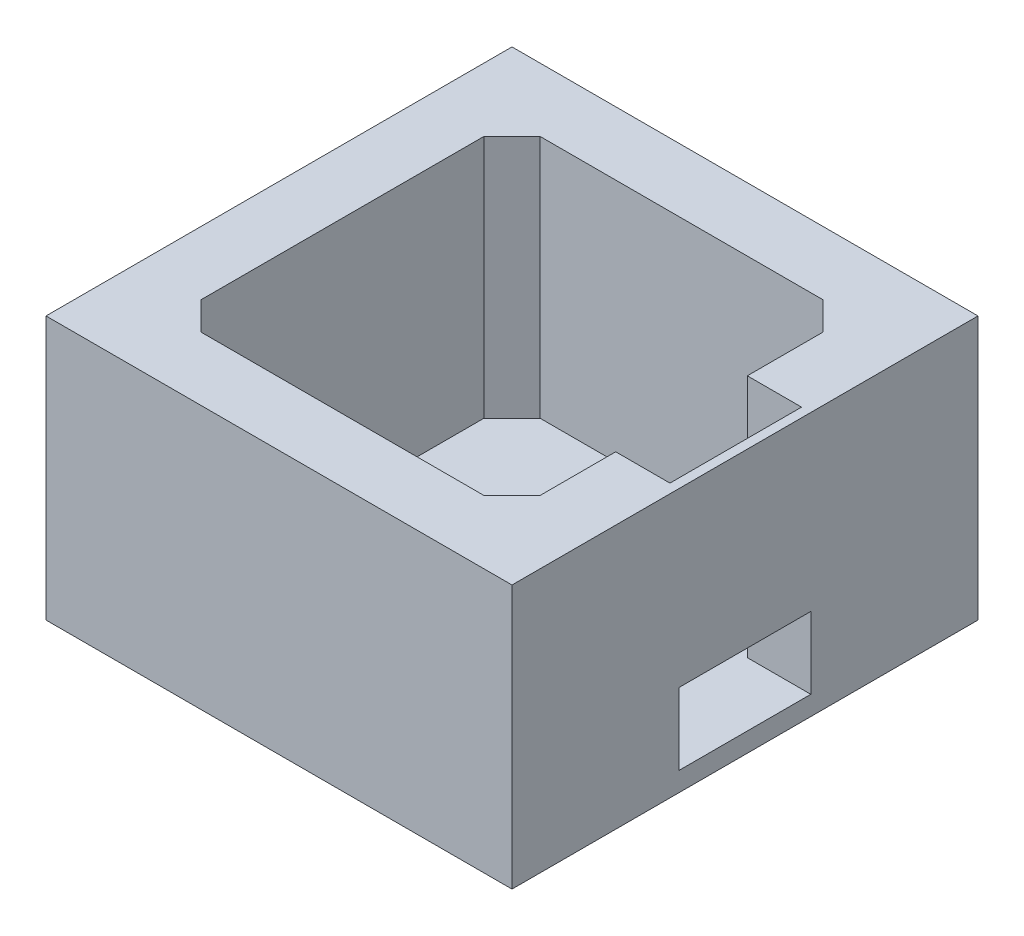
from build123d import *

# Parameters (mm, degrees)
SKETCH1_W           = 58.42
SKETCH1_H           = 58.42
BOSS_EXTRUDE1_DEPTH = 33.02
CUT_EXTRUDE1_DEPTH  = 30.600000014
SKETCH3_W           = 16.5
SKETCH3_H           = 9
CUT_EXTRUDE2_DEPTH  = 30.600000014


with BuildPart() as part:
    # Sketch1 → Boss-Extrude1 (new body)
    with BuildSketch(Plane(origin=(0, 0, 0), x_dir=(1, 0, 0), z_dir=(0, 1, 0))):
        with Locations((29.21, 29.21)):
            Rectangle(SKETCH1_W, SKETCH1_H)
    extrude(amount=BOSS_EXTRUDE1_DEPTH)

    # Sketch2 → Cut-Extrude1 (cut)
    with BuildSketch(Plane(origin=(0, 33.02, 0), x_dir=(1, 0, 0), z_dir=(0, 1, 0))):
        Polygon((11.495533906, 50.46), (46.924466094, 50.46), (50.46, 46.924466094), (50.46, 37.46), (57.26, 37.46), (57.26, 20.96), (50.46, 20.96), (50.46, 11.495533906), (46.924466094, 7.96), (11.495533906, 7.96), (7.96, 11.495533906), (7.96, 46.924466094), align=None)
    extrude(amount=-CUT_EXTRUDE1_DEPTH, mode=Mode.SUBTRACT)

    # Sketch3 → Cut-Extrude2 (cut)
    with BuildSketch(Plane(origin=(58.42, 0, 0), x_dir=(0, 0, -1), z_dir=(1, 0, 0))):
        with Locations((29.21, 6.919999986)):
            Rectangle(SKETCH3_W, SKETCH3_H)
    extrude(amount=-CUT_EXTRUDE2_DEPTH, mode=Mode.SUBTRACT)


solid = part.part
